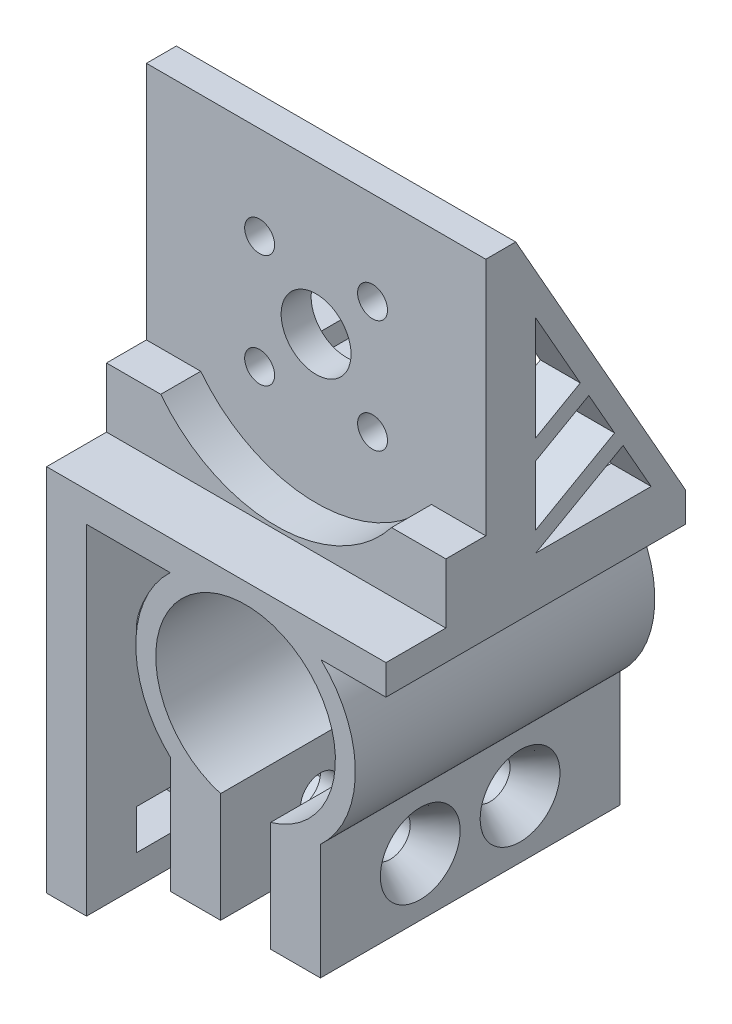
from build123d import *

# Parameters (mm, degrees)
SUPPORTOMOTORE_DEPTH       = 30
SCHIZZO22_W                = 5
SCHIZZO22_H                = 3.93366559
ESTENSIONEBASEVITI_DEPTH   = 30
SCHIZZO12_W                = 41
SCHIZZO12_H                = 37
SUPPORTOESC_DEPTH          = 4
SCHIZZO13_W                = 7
SCHIZZO13_H                = 4
FORIFASCETTA_DEPTH         = 4
PILASTRINIESC_REACH        = 51.759
PILASTRINIESC_END_RADIUS   = 11
SCHIZZO14_R                = 3
SCHIZZO15_W                = 3
SCHIZZO15_H                = 30
BASEMOTORE_DEPTH           = 34
SCHIZZO16_R                = 1.5
SCHIZZO16_R_2              = 3.5
FORIMOTORE_DEPTH           = 3
CONTROVENTODESTRO_DEPTH    = 4
SUPPORTOBASEMOTORE_DEPTH   = 4
FORIVITIAGGANCI_REACH      = 59.738
SCHIZZO20_R                = 2
FORODADO_DEPTH             = 3
FOROTIRANTEANTERIORE_REACH = 63.131
SCHIZZO24_R                = 2.25


with BuildPart() as part:
    # Schizzo1 → SupportoMotore (new body)
    with BuildSketch(Plane.XY):
        with BuildLine():
            Line((-2.5, -10.712142643), (-2.5, -15.712142643))
            Line((-2.5, -15.712142643), (-7.5, -15.712142643))
            Line((-7.5, -15.712142643), (-7.5, -8.04673847))
            ThreePointArc((-7.5, -8.04673847), (-10.999946955, -0.034161219), (-7.549834435, 8))
            Line((-7.549834435, 8), (-15.935446939, 8))
            Line((-15.935446939, 8), (-15.935446939, 11))
            Line((-15.935446939, 11), (14.064553061, 11))
            Line((14.064553061, 11), (14.064553061, 8))
            Line((14.064553061, 8), (7.549834435, 8))
            ThreePointArc((7.549834435, 8), (10.999946955, -0.034161219), (7.5, -8.04673847))
            Line((7.5, -8.04673847), (7.5, -15.712142643))
            Line((7.5, -15.712142643), (2.5, -15.712142643))
            Line((2.5, -15.712142643), (2.5, -10.712142643))
            Line((2.5, -10.712142643), (2.5, -8.645808233))
            ThreePointArc((2.5, -8.645808233), (0, 9), (-2.5, -8.645808233))
            Line((-2.5, -8.645808233), (-2.5, -10.712142643))
        make_face()
    extrude(amount=SUPPORTOMOTORE_DEPTH)

    # Schizzo22 → EstensioneBaseViti (add)
    with BuildSketch(Plane(origin=(0, 0, 0), x_dir=(-1, 0, 0), z_dir=(0, 0, -1))):
        with Locations((-5, -17.678975438)):
            Rectangle(SCHIZZO22_W, SCHIZZO22_H)
        with Locations((5, -17.678975438)):
            Rectangle(SCHIZZO22_W, SCHIZZO22_H)
    extrude(amount=-ESTENSIONEBASEVITI_DEPTH)

    # Schizzo12 → SupportoESC (add)
    with BuildSketch(Plane.ZY.offset(15.935446939)):
        with Locations((9.5, -7.5)):
            Rectangle(SCHIZZO12_W, SCHIZZO12_H)
    extrude(amount=SUPPORTOESC_DEPTH)

    # Schizzo13 → ForiFascetta (cut)
    with BuildSketch(Plane.ZY.offset(19.935446939)):
        with Locations((-2.5, 6)):
            Rectangle(SCHIZZO13_W, SCHIZZO13_H)
        with Locations((21.5, 6)):
            Rectangle(SCHIZZO13_W, SCHIZZO13_H)
        with Locations((21.5, -21)):
            Rectangle(SCHIZZO13_W, SCHIZZO13_H)
        with Locations((-2.5, -21)):
            Rectangle(SCHIZZO13_W, SCHIZZO13_H)
    extrude(amount=-FORIFASCETTA_DEPTH, mode=Mode.SUBTRACT)

    # PilastriniESC: up to this cylinder (the profile starts outside it)
    pilastriniesc_end = Plane(origin=(0, 0, 15), z_dir=(0, 0, -1)) * Cylinder(PILASTRINIESC_END_RADIUS, 140.518, mode=Mode.PRIVATE)
    # Schizzo14 → PilastriniESC (add, up to the surface)
    with BuildSketch(Plane(origin=(-15.935446939, 0, 0), x_dir=(0, 0, -1), z_dir=(1, 0, 0)), mode=Mode.PRIVATE) as pilastriniesc_sk1:
        with Locations(Location((-8, -3.5, 0), (0, 0, 270))):
            Circle(SCHIZZO14_R)
    pilastriniesc_tool1 = extrude(pilastriniesc_sk1.sketch, amount=PILASTRINIESC_REACH, mode=Mode.PRIVATE) - pilastriniesc_end
    add(pilastriniesc_tool1.solids().sort_by_distance((-15.935447, -3.5, 8))[0])
    # Schizzo14 → PilastriniESC (add, up to the surface)
    with BuildSketch(Plane(origin=(-15.935446939, 0, 0), x_dir=(0, 0, -1), z_dir=(1, 0, 0)), mode=Mode.PRIVATE) as pilastriniesc_sk2:
        with Locations(Location((-22, -3.5, 0), (0, 0, 270))):
            Circle(SCHIZZO14_R)
    pilastriniesc_tool2 = extrude(pilastriniesc_sk2.sketch, amount=PILASTRINIESC_REACH, mode=Mode.PRIVATE) - pilastriniesc_end
    add(pilastriniesc_tool2.solids().sort_by_distance((-15.935447, -3.5, 22))[0])

    # Schizzo15 → BaseMotore (add)
    with BuildSketch(Plane.ZY.offset(19.935446939)):
        with Locations((18.5, 26)):
            Rectangle(SCHIZZO15_W, SCHIZZO15_H)
    extrude(amount=-BASEMOTORE_DEPTH)

    # Schizzo16 → ForiMotore (cut)
    with BuildSketch(Plane.XY.offset(20)):
        with Locations((-8.592301188, 31.656854249)):
            Circle(SCHIZZO16_R)
        with Locations((2.721407311, 31.656854249)):
            Circle(SCHIZZO16_R)
        with Locations((2.721407311, 20.343145751)):
            Circle(SCHIZZO16_R)
        with Locations((-8.592301188, 20.343145751)):
            Circle(SCHIZZO16_R)
        with Locations((-2.935446939, 26)):
            Circle(SCHIZZO16_R_2)
    extrude(amount=-FORIMOTORE_DEPTH, mode=Mode.SUBTRACT)

    # Schizzo17 → ControventoDestro (add)
    with BuildSketch(Plane.ZY.offset(19.935446939)):
        Polygon((17, 41), (0, 11), (17, 11), align=None)
        Polygon((15, 15), (15, 21), (9.675284069, 24.017339028), (7.101692816, 19.475707404), align=None, mode=Mode.SUBTRACT)
        Polygon((15, 33.413896553), (10.53314782, 25.531216235), (15, 23), align=None, mode=Mode.SUBTRACT)
        Polygon((3.432125287, 13), (15, 13), (6.243829065, 17.961830197), align=None, mode=Mode.SUBTRACT)
    controventodestro = extrude(amount=-CONTROVENTODESTRO_DEPTH)

    # ControventoSinistro: ControventoDestro across plane
    add(controventodestro.mirror(Plane(origin=(-2.935446939, 0, 0), x_dir=(0, 0, 1), z_dir=(1, 0, 0))))

    # Schizzo19 → SupportoBaseMotore (add)
    with BuildSketch(Plane.XY.offset(20)):
        with BuildLine():
            Line((-19.935446939, 11), (14.064553061, 11))
            Line((14.064553061, 11), (14.064553061, 17))
            Line((14.064553061, 17), (8.624072947, 17))
            ThreePointArc((8.624072947, 17), (-2.935446939, 11.35), (-14.494966825, 17))
            Line((-14.494966825, 17), (-19.935446939, 17))
            Line((-19.935446939, 17), (-19.935446939, 11))
        make_face()
    extrude(amount=SUPPORTOBASEMOTORE_DEPTH)

    # ForiVitiAgganci: up to this face of the body (flat: up to its plane)
    forivitiagganci_end = Plane(part.part.faces().sort_by_distance((-7.5, -13.846273351, 15))[0])
    # Schizzo20 → ForiVitiAgganci (cut, up to the picked face)
    with BuildSketch(Plane(origin=(7.5, 0, 0), x_dir=(0, 0, -1), z_dir=(1, 0, 0)), mode=Mode.PRIVATE) as forivitiagganci_sk1:
        with Locations((-20, -13.846273351)):
            Circle(SCHIZZO20_R)
    forivitiagganci_tool1 = split(extrude(forivitiagganci_sk1.sketch, amount=-FORIVITIAGGANCI_REACH, mode=Mode.PRIVATE), bisect_by=forivitiagganci_end, keep=Keep.BOTH, mode=Mode.PRIVATE)
    # Schizzo20 → ForiVitiAgganci (cut, up to the picked face)
    with BuildSketch(Plane(origin=(7.5, 0, 0), x_dir=(0, 0, -1), z_dir=(1, 0, 0)), mode=Mode.PRIVATE) as forivitiagganci_sk2:
        with Locations((-10, -13.846273351)):
            Circle(SCHIZZO20_R)
    forivitiagganci_tool2 = split(extrude(forivitiagganci_sk2.sketch, amount=-FORIVITIAGGANCI_REACH, mode=Mode.PRIVATE), bisect_by=forivitiagganci_end, keep=Keep.BOTH, mode=Mode.PRIVATE)
    add(forivitiagganci_tool1.solids().sort_by(Axis((7.5, -13.846273, 20), (-1, 0, 0)))[0], mode=Mode.SUBTRACT)
    add(forivitiagganci_tool2.solids().sort_by(Axis((7.5, -13.846273, 10), (-1, 0, 0)))[0], mode=Mode.SUBTRACT)

    # Schizzo21 → SvasaturaViteDestra (revolve, cut)
    with BuildSketch(Plane.XY.offset(10), mode=Mode.PRIVATE) as svasaturavitedestra_sk:
        Polygon((7.5, -9.846273351), (4.5, -11.846273351), (4.5, -13.846273351), (7.5, -13.846273351), align=None)
    svasaturavitedestra = revolve(svasaturavitedestra_sk.sketch.rotate(Axis((4.5, -13.846273351, 10), (1, 0, 0)), 270), axis=Axis((4.5, -13.846273351, 10), (1, 0, 0)), mode=Mode.SUBTRACT)

    # SvasaturaViteSinistra: SvasaturaViteDestra across plane
    add(svasaturavitedestra.mirror(Plane.XY.offset(15)), mode=Mode.SUBTRACT)

    # Schizzo23 → ForoDado (cut)
    with BuildSketch(Plane.ZY.offset(7.5)):
        Polygon((6.102885683, -11.596273351), (6.102885683, -16.096273351), (10, -18.346273351), (13.897114317, -16.096273351), (13.897114317, -11.596273351), (10, -9.346273351), align=None)
        Polygon((16.102885683, -11.596273351), (16.102885683, -16.096273351), (20, -18.346273351), (23.897114317, -16.096273351), (23.897114317, -11.596273351), (20, -9.346273351), align=None)
    extrude(amount=-FORODADO_DEPTH, mode=Mode.SUBTRACT)

    # Schizzo24 → ForoTiranteAnteriore (cut, up to next)
    with BuildSketch(Plane.ZY.offset(19.935446939), mode=Mode.PRIVATE) as forotiranteanteriore_sk1:
        with Locations(Location((9.5, -21, 0), (0, 0, 270))):
            Circle(SCHIZZO24_R)
    forotiranteanteriore_tool1 = extrude(forotiranteanteriore_sk1.sketch, amount=-FOROTIRANTEANTERIORE_REACH, mode=Mode.PRIVATE) & part.part
    add(forotiranteanteriore_tool1.solids().sort_by_distance((-19.935447, -21, 9.5))[0], mode=Mode.SUBTRACT)


solid = part.part
